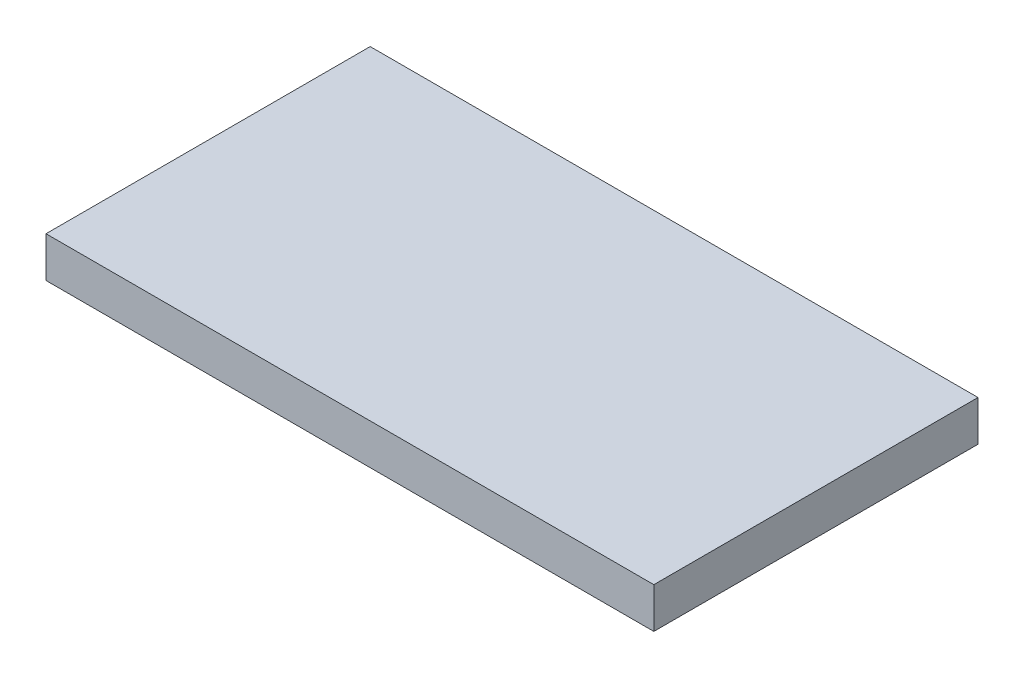
from build123d import *

# Parameters (mm, degrees)
CROQUIS1_W              = 130
CROQUIS1_H              = 60
SALIENTE_EXTRUIR1_DEPTH = 7.5
CROQUIS1_4_W            = 150
CROQUIS1_4_H            = 80
SALIENTE_EXTRUIR2_DEPTH = 10


with BuildPart() as part:
    # Croquis1 → Saliente-Extruir1 (new body)
    with BuildSketch(Plane(origin=(0, 0, 0), x_dir=(1, 0, 0), z_dir=(0, 1, 0))):
        Rectangle(CROQUIS1_W, CROQUIS1_H)
    extrude(amount=-SALIENTE_EXTRUIR1_DEPTH)

    # Croquis1<4> → Saliente-Extruir2 (add)
    with BuildSketch(Plane(origin=(0, 0, 0), x_dir=(1, 0, 0), z_dir=(0, 1, 0))):
        Rectangle(CROQUIS1_4_W, CROQUIS1_4_H)
    extrude(amount=SALIENTE_EXTRUIR2_DEPTH)


solid = part.part
